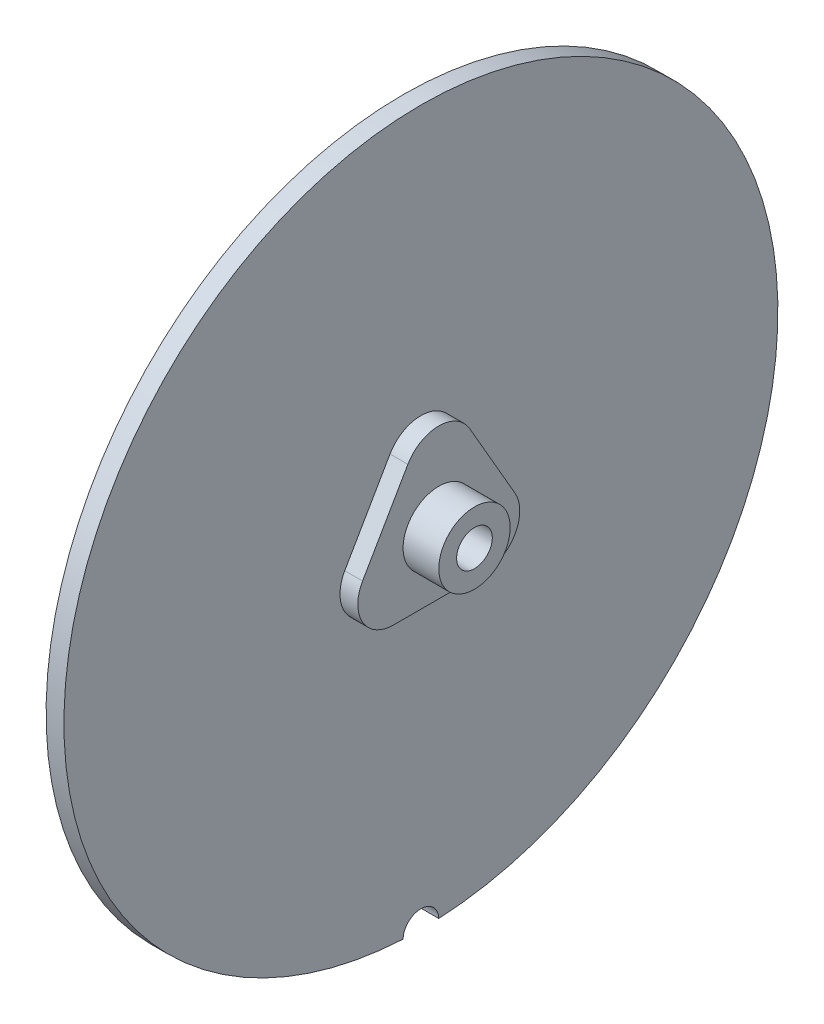
from build123d import *

# Parameters (mm, degrees)
SKETCH1_R           = 3.175
BOSS_EXTRUDE1_DEPTH = 3.175
SKETCH3_R           = 3.175
BOSS_EXTRUDE2_DEPTH = 3.175
SKETCH4_R           = 6.35
SKETCH4_R_2         = 3.175
BOSS_EXTRUDE3_DEPTH = 6.35
FILLET1_R           = 6.35


with BuildPart() as part:
    # Sketch1 → Boss-Extrude1 (new body)
    with BuildSketch(Plane(origin=(0, 0, 0), x_dir=(0, 0, -1), z_dir=(1, 0, 0))):
        with BuildLine():
            ThreePointArc((3.174007657, -63.420625), (0, -60.325), (-3.174007657, -63.420625))
            ThreePointArc((-3.174007657, -63.420625), (0, 63.5), (3.174007657, -63.420625))
        make_face()
        Circle(SKETCH1_R, mode=Mode.SUBTRACT)
    extrude(amount=BOSS_EXTRUDE1_DEPTH)

    # Sketch3 → Boss-Extrude2 (add)
    with BuildSketch(Plane(origin=(3.175, 0, 0), x_dir=(0, 0, -1), z_dir=(1, 0, 0))):
        Polygon((0, 21.997045256), (-19.05, -10.998522628), (19.05, -10.998522628), align=None)
        Circle(SKETCH3_R, mode=Mode.SUBTRACT)
    extrude(amount=BOSS_EXTRUDE2_DEPTH)

    # Sketch4 → Boss-Extrude3 (add)
    with BuildSketch(Plane(origin=(6.35, 0, 0), x_dir=(0, 0, -1), z_dir=(1, 0, 0))):
        Circle(SKETCH4_R)
        Circle(SKETCH4_R_2, mode=Mode.SUBTRACT)
    extrude(amount=BOSS_EXTRUDE3_DEPTH)

    # Fillet1
    fillet1_edges = [part.edges().sort_by_distance(p)[0] for p in [
        (4.7625, -10.998522628, -19.05),
        (4.7625, 21.997045256, 0),
        (4.7625, -10.998522628, 19.05),
    ]]
    fillet(fillet1_edges, radius=FILLET1_R)


solid = part.part
